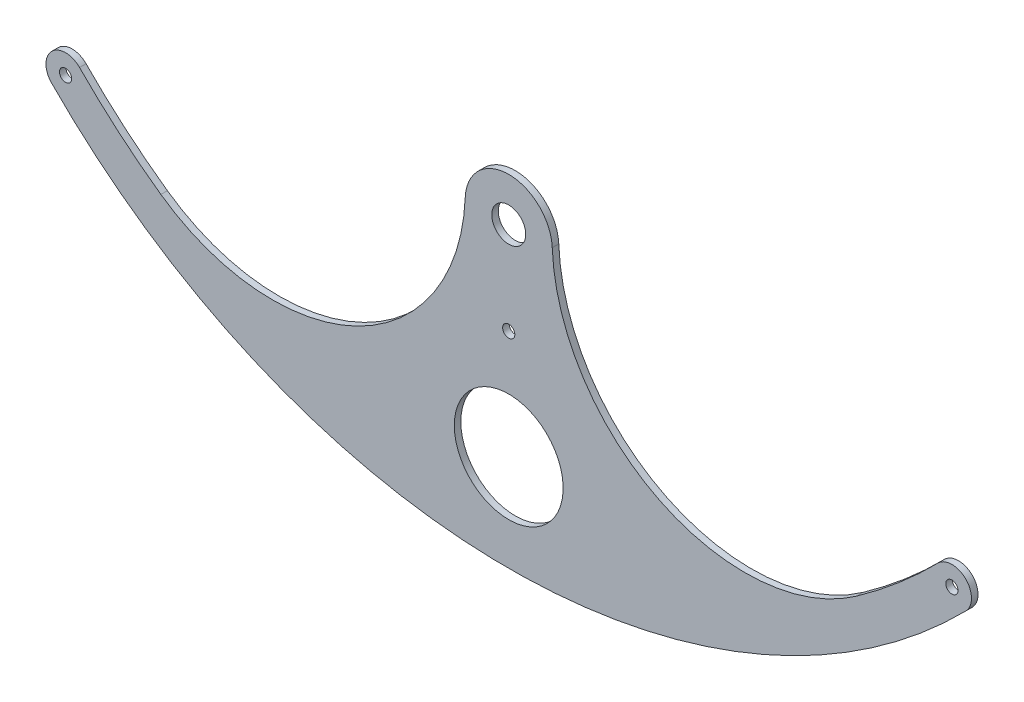
from build123d import *

# Parameters (mm, degrees)
SKETCH1_R           = 1.778
SKETCH1_R_2         = 4.953
SKETCH1_R_3         = 15.875
BOSS_EXTRUDE1_DEPTH = 1.905


with BuildPart() as part:
    # Sketch1 → Boss-Extrude1 (new body)
    with BuildSketch(Plane.XY):
        with BuildLine():
            ThreePointArc((-133.362998698, -4.004910313), (0, -59.943777505), (133.362998698, -4.004910313))
            ThreePointArc((133.362998698, -4.004910313), (133.290910313, 4.076998698), (125.209001302, 4.004910313))
            ThreePointArc((125.209001302, 4.004910313), (113.793114712, -6.627142221), (101.478252071, -16.203528066))
            ThreePointArc((101.478252071, -16.203528066), (44.101918402, -20.793056649), (12.689537579, 27.439398908))
            ThreePointArc((12.689537579, 27.439398908), (0, 39.624), (-12.689537579, 27.439398908))
            ThreePointArc((-12.689537579, 27.439398908), (-44.101918402, -20.793056649), (-101.478252071, -16.203528066))
            ThreePointArc((-101.478252071, -16.203528066), (-113.793114712, -6.627142221), (-125.209001302, 4.004910313))
            ThreePointArc((-125.209001302, 4.004910313), (-133.290910313, 4.076998698), (-133.362998698, -4.004910313))
        make_face()
        with Locations(Location((0, 0, 0), (0, 0, 180))):
            Circle(SKETCH1_R, mode=Mode.SUBTRACT)
        with Locations(Location((129.286, 0, 0), (0, 0, 180))):
            Circle(SKETCH1_R, mode=Mode.SUBTRACT)
        with Locations(Location((-129.286, 0, 0), (0, 0, 180))):
            Circle(SKETCH1_R, mode=Mode.SUBTRACT)
        with Locations(Location((0, 26.924, 0), (0, 0, 180))):
            Circle(SKETCH1_R_2, mode=Mode.SUBTRACT)
        with Locations(Location((0, -31.75, 0), (0, 0, 180))):
            Circle(SKETCH1_R_3, mode=Mode.SUBTRACT)
    extrude(amount=BOSS_EXTRUDE1_DEPTH)


solid = part.part
